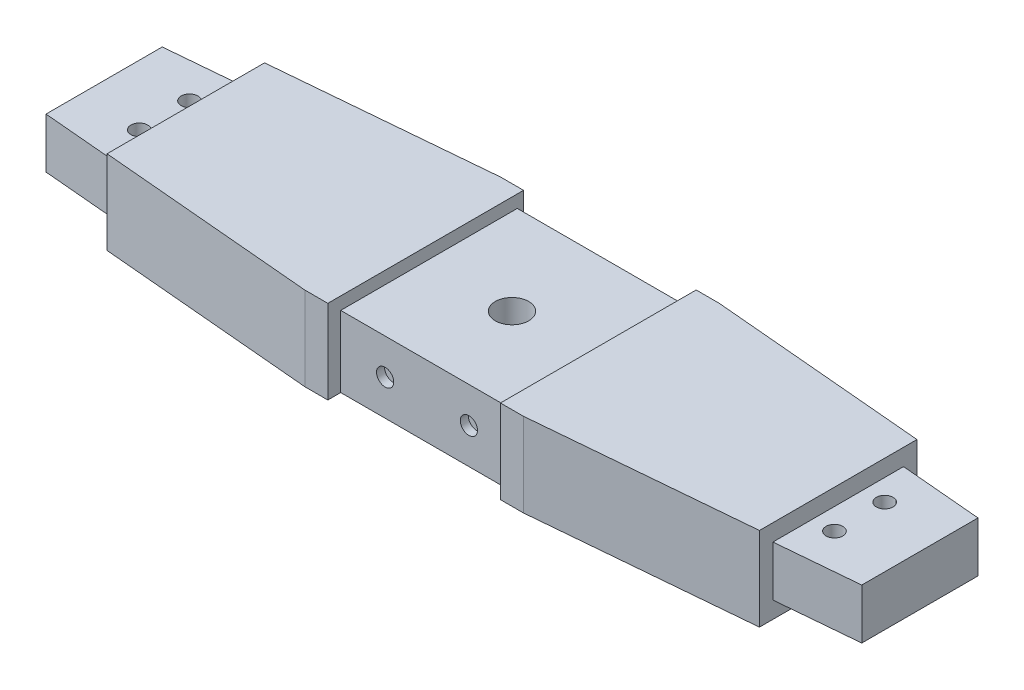
from build123d import *

# Parameters (mm, degrees)
BOSS_EXTRUDE1_DEPTH            = 17
SKETCH2_W                      = 41.219755562
SKETCH2_H                      = 3.074219812
CUT_EXTRUDE1_DEPTH             = 84.08770607
SKETCH3_W                      = 41.219755562
SKETCH3_H                      = 1.5
CUT_EXTRUDE2_DEPTH             = 84.08770607
BOSS_EXTRUDE2_DEPTH            = 3
BOSS_EXTRUDE3_DEPTH            = 3
SKETCH6_W                      = 31.19276455
SKETCH6_H                      = 12
BOSS_EXTRUDE4_DEPTH            = 19.5
SKETCH7_W                      = 31.19276455
SKETCH7_H                      = 12
BOSS_EXTRUDE5_DEPTH            = 19.5
DRAFT1_ANGLE                   = 5.033187306
DRAFT2_ANGLE                   = 5.033187306
F_4_1_4_1_DIAMETER_HOLE1_D     = 4.1
F_4_1_4_1_DIAMETER_HOLE1_DEPTH = 5
F_4_0_4_DIAMETER_HOLE1_D       = 4
F_4_0_4_DIAMETER_HOLE1_DEPTH   = 16
F_8_0_8_DIAMETER_HOLE1_D       = 8
F_8_0_8_DIAMETER_HOLE1_DEPTH   = 20


with BuildPart() as part:
    # Sketch1 → Boss-Extrude1 (new body)
    with BuildSketch(Plane(origin=(0, 13, 0), x_dir=(1, 0, 0), z_dir=(0, 1, 0))):
        Polygon((-26.080793056, -23.37), (26.080793056, -23.37), (77.9, -18.806160436), (77.9, 18.806160436), (26.080793056, 23.37), (-26.080793056, 23.37), (-77.9, 18.806160436), (-77.9, -18.806160436), align=None)
    extrude(amount=-BOSS_EXTRUDE1_DEPTH)

    # Sketch2 → Cut-Extrude1 (cut, through all)
    with BuildSketch(Plane.XZ.offset(4)):
        with Locations((0, 21.832890094)):
            Rectangle(SKETCH2_W, SKETCH2_H)
    extrude(amount=-CUT_EXTRUDE1_DEPTH, mode=Mode.SUBTRACT)

    # Sketch3 → Cut-Extrude2 (cut, through all)
    with BuildSketch(Plane.XZ.offset(4)):
        with Locations((0, -22.62)):
            Rectangle(SKETCH3_W, SKETCH3_H)
    extrude(amount=-CUT_EXTRUDE2_DEPTH, mode=Mode.SUBTRACT)

    # Sketch4 → Boss-Extrude2 (add)
    with BuildSketch(Plane(origin=(0, 13, 0), x_dir=(-1, 0, 0), z_dir=(0, 1, 0))):
        Polygon((-20.609877781, 20.295780188), (-20.609877781, 23.37), (-26.080793056, 23.37), (-77.9, 18.806160436), (-77.9, -18.806160436), (-26.080793056, -23.37), (-20.609877781, -23.37), (-20.609877781, -21.87), align=None)
    extrude(amount=BOSS_EXTRUDE2_DEPTH)

    # Sketch5 → Boss-Extrude3 (add)
    with BuildSketch(Plane(origin=(0, 13, 0), x_dir=(-1, 0, 0), z_dir=(0, 1, 0))):
        Polygon((20.609877781, -21.87), (20.609877781, -23.37), (26.080793056, -23.37), (77.9, -18.806160436), (77.9, 18.806160436), (26.080793056, 23.37), (20.609877781, 23.37), (20.609877781, 20.295780188), align=None)
    extrude(amount=BOSS_EXTRUDE3_DEPTH)

    # Sketch6 → Boss-Extrude4 (add)
    with BuildSketch(Plane(origin=(77.9, 0, 0), x_dir=(0, 0, -1), z_dir=(1, 0, 0))):
        with Locations((0, 6)):
            Rectangle(SKETCH6_W, SKETCH6_H)
    extrude(amount=BOSS_EXTRUDE4_DEPTH)

    # Sketch7 → Boss-Extrude5 (add)
    with BuildSketch(Plane.ZY.offset(77.9)):
        with Locations((0, 6)):
            Rectangle(SKETCH7_W, SKETCH7_H)
    extrude(amount=BOSS_EXTRUDE5_DEPTH)

    # Draft1
    draft1_faces = [part.faces().sort_by_distance(p)[0] for p in [
        (-87.65, 6, 15.596382275),
        (-87.65, 6, -15.596382275),
    ]]
    draft(draft1_faces, Plane(origin=(-77.9, -4, -18.806160436), x_dir=(0, 0, -1), z_dir=(-1, 0, 0)), DRAFT1_ANGLE)

    # Draft2
    draft2_faces = [part.faces().sort_by_distance(p)[0] for p in [
        (87.65, 6, 15.596382275),
        (87.65, 6, -15.596382275),
    ]]
    draft(draft2_faces, Plane(origin=(77.9, -4, 18.806160436), x_dir=(0, 0, 1), z_dir=(1, 0, 0)), DRAFT2_ANGLE)

    # Ø4.1 (4.1) Diameter Hole1
    with Locations(Plane.XY.offset(23.37)):
        with Locations((-10, 4.5), (10, 4.5)):
            Hole(F_4_1_4_1_DIAMETER_HOLE1_D / 2, depth=F_4_1_4_1_DIAMETER_HOLE1_DEPTH)

    # Ø4.0 (4) Diameter Hole1
    with Locations(Plane(origin=(0, 12, 0), x_dir=(1, 0, 0), z_dir=(0, 1, 0))):
        with Locations((-83, 6), (-83, -6), (83, -6), (83, 6)):
            Hole(F_4_0_4_DIAMETER_HOLE1_D / 2, depth=F_4_0_4_DIAMETER_HOLE1_DEPTH)

    # Ø8.0 (8) Diameter Hole1
    with Locations(Plane(origin=(0, -4, 0), x_dir=(-1, 0, 0), z_dir=(0, -1, 0))):
        with Locations((0, 0)):
            Hole(F_8_0_8_DIAMETER_HOLE1_D / 2, depth=F_8_0_8_DIAMETER_HOLE1_DEPTH)


solid = part.part
